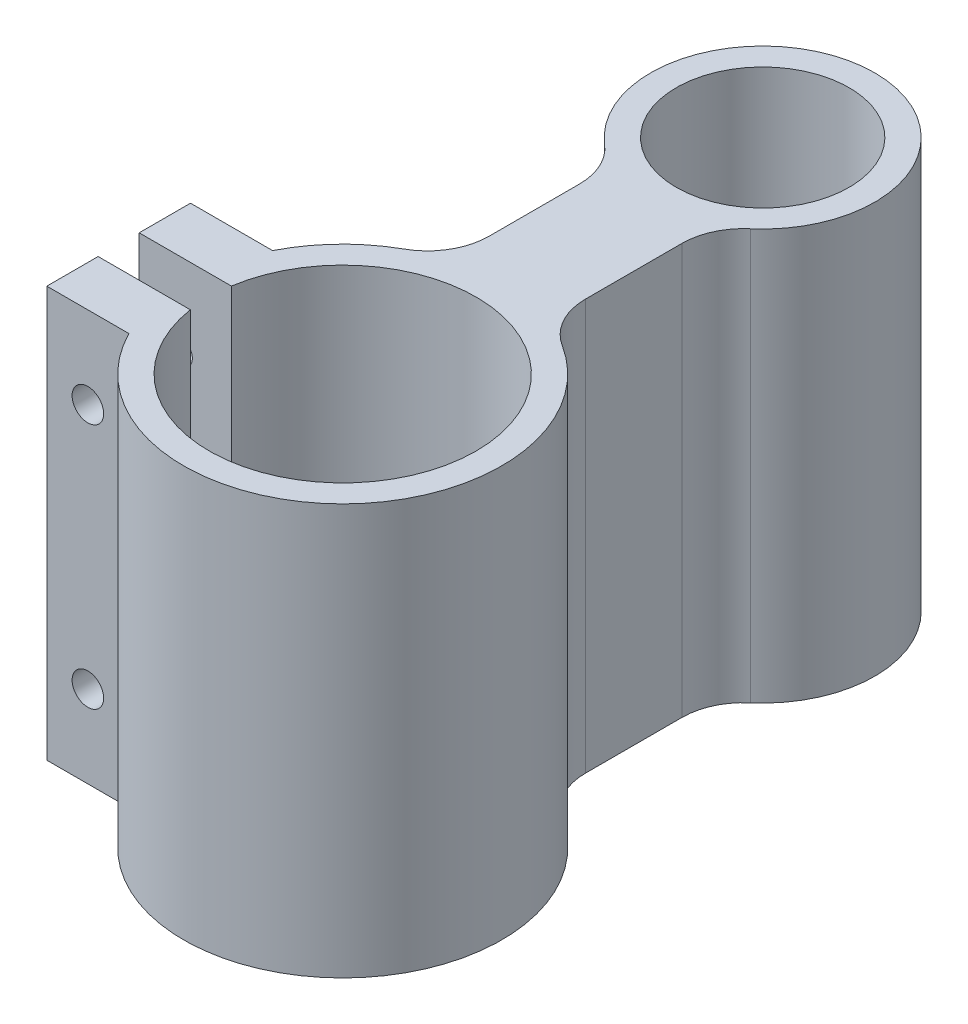
from build123d import *

# Parameters (mm, degrees)
SKETCH1_R           = 10.6934
BOSS_EXTRUDE1_DEPTH = 50.8
FILLET1_R           = 7.62
SKETCH2_R           = 1.95
CUT_EXTRUDE1_DEPTH  = 90.044185298
CUT_EXTRUDE3_REACH  = 82.692
SKETCH3_R           = 1.5


with BuildPart() as part:
    # Sketch1 → Boss-Extrude1 (new body)
    with BuildSketch(Plane(origin=(0, 0, 0), x_dir=(1, 0, 0), z_dir=(0, 1, 0))):
        with BuildLine():
            Line((-27.575797838, -21.068578528), (-27.575797838, -27.418578528))
            Line((-27.575797838, -27.418578528), (-17.415797838, -27.418578528))
            ThreePointArc((-17.415797838, -27.418578528), (14.781852954, -31.694178295), (7.137192233, -0.126336551))
            Line((7.137192233, -0.126336551), (7.137192233, 20.467104736))
            ThreePointArc((7.137192233, 20.467104736), (0.787192233, 46.664739041), (-5.562807767, 20.467104736))
            Line((-5.562807767, 20.467104736), (-5.562807767, 0.310008465))
            ThreePointArc((-5.562807767, 0.310008465), (-12.507890511, -3.450714702), (-17.415797838, -9.638578528))
            Line((-17.415797838, -9.638578528), (-27.575797838, -9.638578528))
            Line((-27.575797838, -9.638578528), (-27.575797838, -15.988578528))
            Line((-27.575797838, -15.988578528), (-16.166011022, -15.988578528))
            ThreePointArc((-16.166011022, -15.988578528), (16.657434353, -18.528578528), (-16.166011022, -21.068578528))
            Line((-16.166011022, -21.068578528), (-27.575797838, -21.068578528))
        make_face()
        with Locations(Location((0.787192233, 32.796339041, 0), (0, 0, 270))):
            Circle(SKETCH1_R, mode=Mode.SUBTRACT)
    extrude(amount=BOSS_EXTRUDE1_DEPTH)

    # Fillet1
    fillet1_edges = [part.edges().sort_by_distance(p)[0] for p in [
        (-5.562807767, 25.4, -0.310008465),
        (7.137192233, 25.4, 0.126336551),
        (-5.562807767, 25.4, -20.467104736),
        (7.137192233, 25.4, -20.467104736),
    ]]
    fillet(fillet1_edges, radius=FILLET1_R)

    # Sketch2 → Cut-Extrude1 (cut, through all)
    with BuildSketch(Plane(origin=(0, 0, 21.068578528), x_dir=(-1, 0, 0), z_dir=(0, 0, -1))):
        with Locations((22.495797838, 40.64)):
            Circle(SKETCH2_R)
        with Locations(Location((22.495797838, 10.16, 0), (0, 0, 180))):
            Circle(SKETCH2_R)
    extrude(amount=-CUT_EXTRUDE1_DEPTH, mode=Mode.SUBTRACT)

    # Sketch3 → Cut-Extrude3 (cut, up to next)
    with BuildSketch(Plane(origin=(0, 0, 9.638578528), x_dir=(-1, 0, 0), z_dir=(0, 0, -1)), mode=Mode.PRIVATE) as cut_extrude3_sk1:
        with Locations((22.495797838, 10.16)):
            Circle(SKETCH3_R)
    cut_extrude3_tool1 = extrude(cut_extrude3_sk1.sketch, amount=-CUT_EXTRUDE3_REACH, mode=Mode.PRIVATE) & part.part
    # Sketch3 → Cut-Extrude3 (cut, up to next)
    with BuildSketch(Plane(origin=(0, 0, 9.638578528), x_dir=(-1, 0, 0), z_dir=(0, 0, -1)), mode=Mode.PRIVATE) as cut_extrude3_sk2:
        with Locations((22.495797838, 40.64)):
            Circle(SKETCH3_R)
    cut_extrude3_tool2 = extrude(cut_extrude3_sk2.sketch, amount=-CUT_EXTRUDE3_REACH, mode=Mode.PRIVATE) & part.part
    add(cut_extrude3_tool1.solids().sort_by_distance((-22.495798, 10.16, 9.638579))[0], mode=Mode.SUBTRACT)
    add(cut_extrude3_tool2.solids().sort_by_distance((-22.495798, 40.64, 9.638579))[0], mode=Mode.SUBTRACT)


solid = part.part
